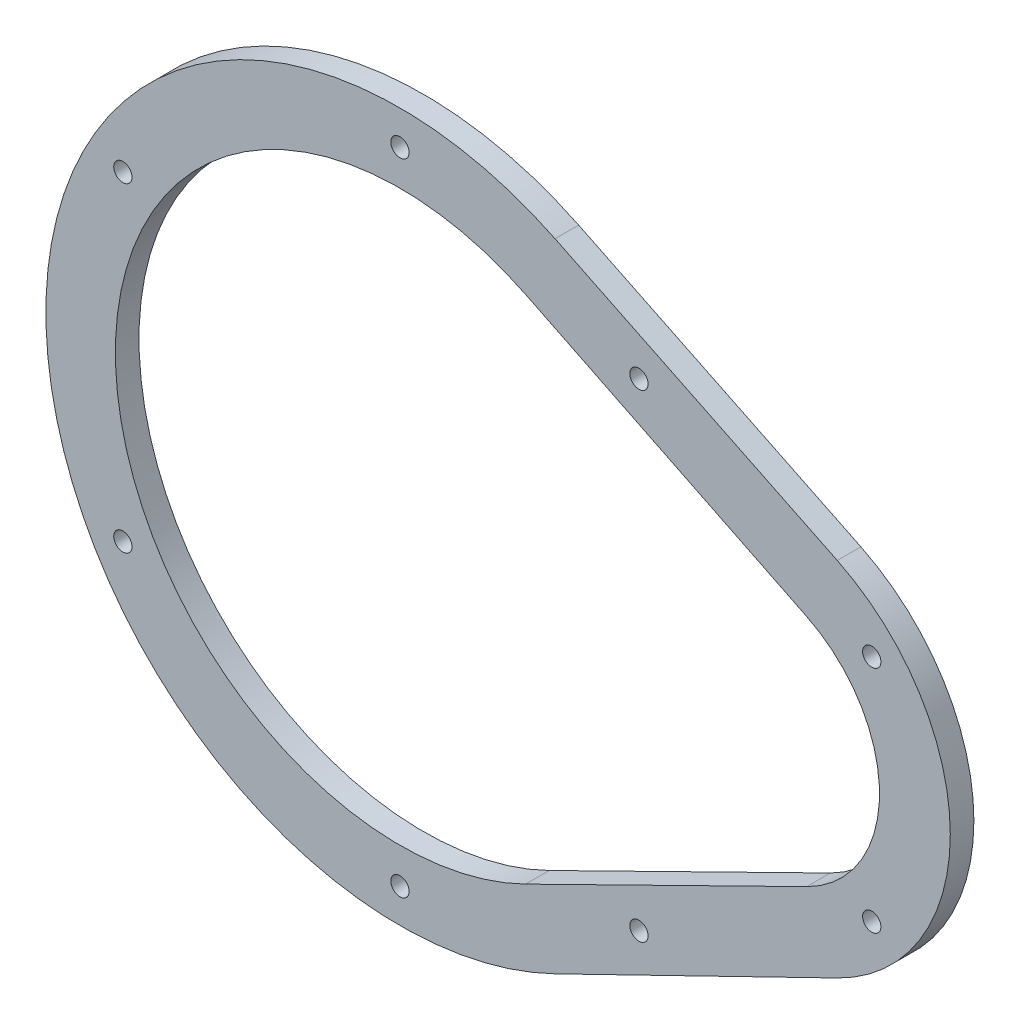
from build123d import *

# Parameters (mm, degrees)
BOSS_EXTRUDE2_DEPTH     = 4
CUT_EXTRUDE4_DEPTH      = 6
CUT_EXTRUDE4_DEPTH_BACK = 111.961995243
SKETCH11_R              = 1.55


with BuildPart() as part:
    # Sketch1 → Boss-Extrude2 (new body)
    with BuildSketch(Plane.XY):
        with BuildLine():
            Line((26.280991736, 53.938015104), (74.102766205, 30.637126906))
            ThreePointArc((74.102766205, 30.637126906), (93.255371901, 0), (74.102766205, -30.637126906))
            Line((74.102766205, -30.637126906), (26.280991736, -53.938015104))
            ThreePointArc((26.280991736, -53.938015104), (-60, 0), (26.280991736, 53.938015104))
        make_face()
        with BuildLine():
            Line((21.297534718, 43.26272971), (68.929300346, 19.81439002))
            ThreePointArc((68.929300346, 19.81439002), (81.260208333, 0), (68.929300346, -19.81439002))
            Line((68.929300346, -19.81439002), (21.297534718, -43.26272971))
            ThreePointArc((21.297534718, -43.26272971), (-48.22083333, 0), (21.297534718, 43.26272971))
        make_face(mode=Mode.SUBTRACT)
    extrude(amount=BOSS_EXTRUDE2_DEPTH)

    # Sketch11 → Cut-Extrude4 (cut, two sides: drawn at the far end of the back side and taken through both)
    with BuildSketch(Plane.XY.offset(4).offset(-CUT_EXTRUDE4_DEPTH_BACK)):
        with Locations((0, 54.22083333)):
            Circle(SKETCH11_R)
        with Locations((-46.956619078, 27.110416665)):
            Circle(SKETCH11_R)
        with Locations((-46.956619078, -27.110416665)):
            Circle(SKETCH11_R)
        with Locations((0, -54.22083333)):
            Circle(SKETCH11_R)
        with Locations((79.945436483, 19.445436483)):
            Circle(SKETCH11_R)
        with Locations((40.498188633, 40.498188633)):
            Circle(SKETCH11_R)
        with Locations(Location((79.945436483, -19.445436483, 0), (0, 0, 180))):
            Circle(SKETCH11_R)
        with Locations(Location((40.498188633, -40.498188633, 0), (0, 0, 180))):
            Circle(SKETCH11_R)
    extrude(amount=CUT_EXTRUDE4_DEPTH + CUT_EXTRUDE4_DEPTH_BACK, mode=Mode.SUBTRACT)


solid = part.part
